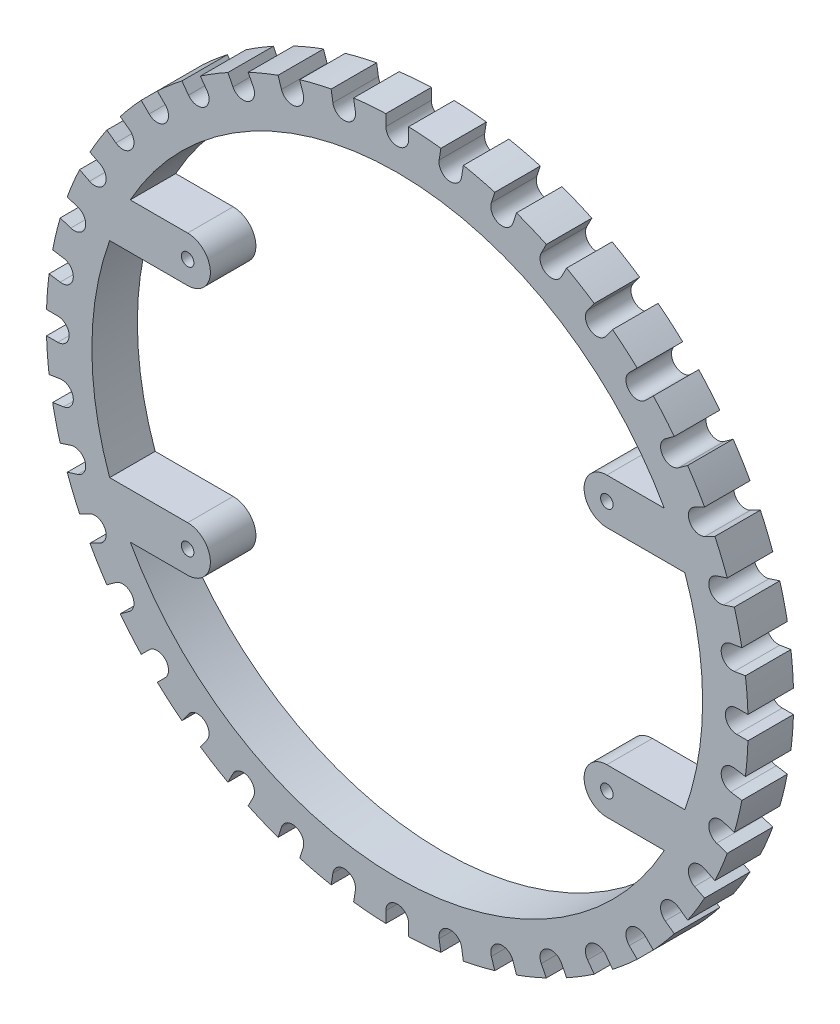
from build123d import *

# Parameters (mm, degrees)
SKETCH1_R           = 1.75
BOSS_EXTRUDE1_DEPTH = 12.7


with BuildPart() as part:
    # Sketch1 → Boss-Extrude1 (new body)
    with BuildSketch(Plane.XY):
        with BuildLine():
            Line((-3.175, -97.873515314), (-3.175, -94.75))
            ThreePointArc((-3.175, -94.75), (0, -91.575), (3.175, -94.75))
            Line((3.175, -94.75), (3.175, -97.873515314))
            ThreePointArc((3.175, -97.873515314), (7.683106949, -97.623129906), (12.174880528, -97.165209356))
            Line((12.174880528, -97.165209356), (11.686255081, -94.080149698))
            ThreePointArc((11.686255081, -94.080149698), (14.325486136, -90.44755979), (17.958076044, -93.086790845))
            Line((17.958076044, -93.086790845), (18.446701491, -96.171850503))
            ThreePointArc((18.446701491, -96.171850503), (22.860137256, -95.219324455), (27.224975092, -94.06437347))
            Line((27.224975092, -94.06437347), (26.259755778, -91.093733876))
            ThreePointArc((26.259755778, -91.093733876), (28.29823126, -87.09300048), (32.298964656, -89.131475962))
            Line((32.298964656, -89.131475962), (33.264183971, -92.102115555))
            ThreePointArc((33.264183971, -92.102115555), (37.474275114, -90.470903221), (41.604700415, -88.647360527))
            Line((41.604700415, -88.647360527), (40.186654136, -85.864288004))
            ThreePointArc((40.186654136, -85.864288004), (41.574180014, -81.593922453), (45.844545565, -82.98144833))
            Line((45.844545565, -82.98144833), (47.262591843, -85.764520854))
            ThreePointArc((47.262591843, -85.764520854), (51.16567195, -83.494788094), (54.959979935, -81.047555365))
            Line((54.959979935, -81.047555365), (53.124023698, -78.520578393))
            ThreePointArc((53.124023698, -78.520578393), (53.826434479, -74.08573126), (58.261281612, -74.788142041))
            Line((58.261281612, -74.788142041), (60.097237849, -77.315119013))
            ThreePointArc((60.097237849, -77.315119013), (63.597200133, -74.462754181), (66.961962347, -71.452090408))
            Line((66.961962347, -71.452090408), (64.753303487, -69.243431548))
            ThreePointArc((64.753303487, -69.243431548), (64.753303487, -64.753303487), (69.243431548, -64.753303487))
            Line((69.243431548, -64.753303487), (71.452090408, -66.961962347))
            ThreePointArc((71.452090408, -66.961962347), (74.462754181, -63.597200133), (77.315119013, -60.097237849))
            Line((77.315119013, -60.097237849), (74.788142041, -58.261281612))
            ThreePointArc((74.788142041, -58.261281612), (74.08573126, -53.826434479), (78.520578393, -53.124023698))
            Line((78.520578393, -53.124023698), (81.047555365, -54.959979935))
            ThreePointArc((81.047555365, -54.959979935), (83.494788094, -51.16567195), (85.764520854, -47.262591843))
            Line((85.764520854, -47.262591843), (82.98144833, -45.844545565))
            ThreePointArc((82.98144833, -45.844545565), (81.593922453, -41.574180014), (85.864288004, -40.186654136))
            Line((85.864288004, -40.186654136), (88.647360527, -41.604700415))
            ThreePointArc((88.647360527, -41.604700415), (90.470903221, -37.474275114), (92.102115555, -33.264183971))
            Line((92.102115555, -33.264183971), (89.131475962, -32.298964656))
            ThreePointArc((89.131475962, -32.298964656), (87.09300048, -28.29823126), (91.093733876, -26.259755778))
            Line((91.093733876, -26.259755778), (94.06437347, -27.224975092))
            ThreePointArc((94.06437347, -27.224975092), (95.219324455, -22.860137256), (96.171850503, -18.446701491))
            Line((96.171850503, -18.446701491), (93.086790845, -17.958076044))
            ThreePointArc((93.086790845, -17.958076044), (90.44755979, -14.325486136), (94.080149698, -11.686255081))
            Line((94.080149698, -11.686255081), (97.165209356, -12.174880528))
            ThreePointArc((97.165209356, -12.174880528), (97.623129906, -7.683106949), (97.873515314, -3.175))
            Line((97.873515314, -3.175), (94.75, -3.175))
            ThreePointArc((94.75, -3.175), (91.575, 0), (94.75, 3.175))
            Line((94.75, 3.175), (97.873515314, 3.175))
            ThreePointArc((97.873515314, 3.175), (97.623129906, 7.683106949), (97.165209356, 12.174880528))
            Line((97.165209356, 12.174880528), (94.080149698, 11.686255081))
            ThreePointArc((94.080149698, 11.686255081), (90.44755979, 14.325486136), (93.086790845, 17.958076044))
            Line((93.086790845, 17.958076044), (96.171850503, 18.446701491))
            ThreePointArc((96.171850503, 18.446701491), (95.219324455, 22.860137256), (94.06437347, 27.224975092))
            Line((94.06437347, 27.224975092), (91.093733876, 26.259755778))
            ThreePointArc((91.093733876, 26.259755778), (87.09300048, 28.29823126), (89.131475962, 32.298964656))
            Line((89.131475962, 32.298964656), (92.102115555, 33.264183971))
            ThreePointArc((92.102115555, 33.264183971), (90.470903221, 37.474275114), (88.647360527, 41.604700415))
            Line((88.647360527, 41.604700415), (85.864288004, 40.186654136))
            ThreePointArc((85.864288004, 40.186654136), (81.593922453, 41.574180014), (82.98144833, 45.844545565))
            Line((82.98144833, 45.844545565), (85.764520854, 47.262591843))
            ThreePointArc((85.764520854, 47.262591843), (83.494788094, 51.16567195), (81.047555365, 54.959979935))
            Line((81.047555365, 54.959979935), (78.520578393, 53.124023698))
            ThreePointArc((78.520578393, 53.124023698), (74.08573126, 53.826434479), (74.788142041, 58.261281612))
            Line((74.788142041, 58.261281612), (77.315119013, 60.097237849))
            ThreePointArc((77.315119013, 60.097237849), (74.462754181, 63.597200133), (71.452090408, 66.961962347))
            Line((71.452090408, 66.961962347), (69.243431548, 64.753303487))
            ThreePointArc((69.243431548, 64.753303487), (64.753303487, 64.753303487), (64.753303487, 69.243431548))
            Line((64.753303487, 69.243431548), (66.961962347, 71.452090408))
            ThreePointArc((66.961962347, 71.452090408), (63.597200133, 74.462754181), (60.097237849, 77.315119013))
            Line((60.097237849, 77.315119013), (58.261281612, 74.788142041))
            ThreePointArc((58.261281612, 74.788142041), (53.826434479, 74.08573126), (53.124023698, 78.520578393))
            Line((53.124023698, 78.520578393), (54.959979935, 81.047555365))
            ThreePointArc((54.959979935, 81.047555365), (51.16567195, 83.494788094), (47.262591843, 85.764520854))
            Line((47.262591843, 85.764520854), (45.844545565, 82.98144833))
            ThreePointArc((45.844545565, 82.98144833), (41.574180014, 81.593922453), (40.186654136, 85.864288004))
            Line((40.186654136, 85.864288004), (41.604700415, 88.647360527))
            ThreePointArc((41.604700415, 88.647360527), (37.474275114, 90.470903221), (33.264183971, 92.102115555))
            Line((33.264183971, 92.102115555), (32.298964656, 89.131475962))
            ThreePointArc((32.298964656, 89.131475962), (28.29823126, 87.09300048), (26.259755778, 91.093733876))
            Line((26.259755778, 91.093733876), (27.224975092, 94.06437347))
            ThreePointArc((27.224975092, 94.06437347), (22.860137256, 95.219324455), (18.446701491, 96.171850503))
            Line((18.446701491, 96.171850503), (17.958076044, 93.086790845))
            ThreePointArc((17.958076044, 93.086790845), (14.325486136, 90.44755979), (11.686255081, 94.080149698))
            Line((11.686255081, 94.080149698), (12.174880528, 97.165209356))
            ThreePointArc((12.174880528, 97.165209356), (7.683106949, 97.623129906), (3.175, 97.873515314))
            Line((3.175, 97.873515314), (3.175, 94.75))
            ThreePointArc((3.175, 94.75), (0, 91.575), (-3.175, 94.75))
            Line((-3.175, 94.75), (-3.175, 97.873515314))
            ThreePointArc((-3.175, 97.873515314), (-7.683106949, 97.623129906), (-12.174880528, 97.165209356))
            Line((-12.174880528, 97.165209356), (-11.686255081, 94.080149698))
            ThreePointArc((-11.686255081, 94.080149698), (-11.656953028, 93.8325779), (-11.647165563, 93.583470271))
            ThreePointArc((-11.647165563, 93.583470271), (-14.573057934, 90.418257737), (-17.958076044, 93.086790845))
            Line((-17.958076044, 93.086790845), (-18.446701491, 96.171850503))
            ThreePointArc((-18.446701491, 96.171850503), (-22.860137256, 95.219324455), (-27.224975092, 94.06437347))
            Line((-27.224975092, 94.06437347), (-26.259755778, 91.093733876))
            ThreePointArc((-26.259755778, 91.093733876), (-26.143449736, 90.609284345), (-26.104360217, 90.112604919))
            ThreePointArc((-26.104360217, 90.112604919), (-28.782680791, 86.976694438), (-32.298964656, 89.131475962))
            Line((-32.298964656, 89.131475962), (-33.264183971, 92.102115555))
            ThreePointArc((-33.264183971, 92.102115555), (-37.474275114, 90.470903221), (-41.604700415, 88.647360527))
            Line((-41.604700415, 88.647360527), (-40.186654136, 85.864288004))
            ThreePointArc((-40.186654136, 85.864288004), (-39.928325353, 85.164057197), (-39.84059985, 84.422868167))
            ThreePointArc((-39.84059985, 84.422868167), (-42.27441082, 81.33559367), (-45.844545565, 82.98144833))
            Line((-45.844545565, 82.98144833), (-47.262591843, 85.764520854))
            ThreePointArc((-47.262591843, 85.764520854), (-51.16567195, 83.494788094), (-54.959979935, 81.047555365))
            Line((-54.959979935, 81.047555365), (-53.124023698, 78.520578393))
            ThreePointArc((-53.124023698, 78.520578393), (-52.673048215, 77.635489174), (-52.517652655, 76.654360217))
            ThreePointArc((-52.517652655, 76.654360217), (-54.711523698, 73.634755778), (-58.261281612, 74.788142041))
            Line((-58.261281612, 74.788142041), (-60.097237849, 77.315119013))
            ThreePointArc((-60.097237849, 77.315119013), (-63.597200133, 74.462754181), (-66.961962347, 71.452090408))
            Line((-66.961962347, 71.452090408), (-64.753303487, 69.243431548))
            ThreePointArc((-64.753303487, 69.243431548), (-64.065050002, 68.213387415), (-63.823367517, 66.998367517))
            ThreePointArc((-63.823367517, 66.998367517), (-65.78334762, 64.065050002), (-69.243431548, 64.753303487))
            Line((-69.243431548, 64.753303487), (-71.452090408, 66.961962347))
            ThreePointArc((-71.452090408, 66.961962347), (-74.462754181, 63.597200133), (-77.315119013, 60.097237849))
            Line((-77.315119013, 60.097237849), (-74.788142041, 58.261281612))
            ThreePointArc((-74.788142041, 58.261281612), (-73.825414503, 57.134072491), (-73.479360217, 55.692652655))
            ThreePointArc((-73.479360217, 55.692652655), (-75.21294038, 52.86370694), (-78.520578393, 53.124023698))
            Line((-78.520578393, 53.124023698), (-81.047555365, 54.959979935))
            ThreePointArc((-81.047555365, 54.959979935), (-83.494788094, 51.16567195), (-85.764520854, 47.262591843))
            Line((-85.764520854, 47.262591843), (-82.98144833, 45.844545565))
            ThreePointArc((-82.98144833, 45.844545565), (-81.715735645, 44.674532793), (-81.247868167, 43.01559985))
            ThreePointArc((-81.247868167, 43.01559985), (-82.763935224, 40.308467328), (-85.864288004, 40.186654136))
            Line((-85.864288004, 40.186654136), (-88.647360527, 41.604700415))
            ThreePointArc((-88.647360527, 41.604700415), (-90.470903221, 37.474275114), (-92.102115555, 33.264183971))
            Line((-92.102115555, 33.264183971), (-89.131475962, 32.298964656))
            ThreePointArc((-89.131475962, 32.298964656), (-87.543975962, 31.145578393), (-86.937604919, 29.279360217))
            ThreePointArc((-86.937604919, 29.279360217), (-88.246386743, 26.71073126), (-91.093733876, 26.259755778))
            Line((-91.093733876, 26.259755778), (-94.06437347, 27.224975092))
            ThreePointArc((-94.06437347, 27.224975092), (-95.219324455, 22.860137256), (-96.171850503, 18.446701491))
            Line((-96.171850503, 18.446701491), (-93.086790845, 17.958076044))
            ThreePointArc((-93.086790845, 17.958076044), (-91.169181331, 16.884163116), (-90.408470271, 14.822165563))
            ThreePointArc((-90.408470271, 14.822165563), (-91.521472718, 12.407876622), (-94.080149698, 11.686255081))
            Line((-94.080149698, 11.686255081), (-97.165209356, 12.174880528))
            ThreePointArc((-97.165209356, 12.174880528), (-97.623129906, 7.683106949), (-97.873515314, 3.175))
            Line((-97.873515314, 3.175), (-94.75, 3.175))
            ThreePointArc((-94.75, 3.175), (-92.50493597, 2.24506403), (-91.575, 0))
            ThreePointArc((-91.575, 0), (-92.50493597, -2.24506403), (-94.75, -3.175))
            Line((-94.75, -3.175), (-97.873515314, -3.175))
            ThreePointArc((-97.873515314, -3.175), (-97.623129906, -7.683106949), (-97.165209356, -12.174880528))
            Line((-97.165209356, -12.174880528), (-94.080149698, -11.686255081))
            ThreePointArc((-94.080149698, -11.686255081), (-91.521472718, -12.407876622), (-90.408470271, -14.822165563))
            ThreePointArc((-90.408470271, -14.822165563), (-91.169181331, -16.884163116), (-93.086790845, -17.958076044))
            Line((-93.086790845, -17.958076044), (-96.171850503, -18.446701491))
            ThreePointArc((-96.171850503, -18.446701491), (-95.219324455, -22.860137256), (-94.06437347, -27.224975092))
            Line((-94.06437347, -27.224975092), (-91.093733876, -26.259755778))
            ThreePointArc((-91.093733876, -26.259755778), (-88.246386743, -26.71073126), (-86.937604919, -29.279360217))
            ThreePointArc((-86.937604919, -29.279360217), (-87.543975962, -31.145578393), (-89.131475962, -32.298964656))
            Line((-89.131475962, -32.298964656), (-92.102115555, -33.264183971))
            ThreePointArc((-92.102115555, -33.264183971), (-90.470903221, -37.474275114), (-88.647360527, -41.604700415))
            Line((-88.647360527, -41.604700415), (-85.864288004, -40.186654136))
            ThreePointArc((-85.864288004, -40.186654136), (-82.763935224, -40.308467328), (-81.247868167, -43.01559985))
            ThreePointArc((-81.247868167, -43.01559985), (-81.715735645, -44.674532793), (-82.98144833, -45.844545565))
            Line((-82.98144833, -45.844545565), (-85.764520854, -47.262591843))
            ThreePointArc((-85.764520854, -47.262591843), (-83.494788094, -51.16567195), (-81.047555365, -54.959979935))
            Line((-81.047555365, -54.959979935), (-78.520578393, -53.124023698))
            ThreePointArc((-78.520578393, -53.124023698), (-75.21294038, -52.86370694), (-73.479360217, -55.692652655))
            ThreePointArc((-73.479360217, -55.692652655), (-73.825414503, -57.134072491), (-74.788142041, -58.261281612))
            Line((-74.788142041, -58.261281612), (-77.315119013, -60.097237849))
            ThreePointArc((-77.315119013, -60.097237849), (-74.462754181, -63.597200133), (-71.452090408, -66.961962347))
            Line((-71.452090408, -66.961962347), (-69.243431548, -64.753303487))
            ThreePointArc((-69.243431548, -64.753303487), (-65.78334762, -64.065050002), (-63.823367517, -66.998367517))
            ThreePointArc((-63.823367517, -66.998367517), (-64.065050002, -68.213387415), (-64.753303487, -69.243431548))
            Line((-64.753303487, -69.243431548), (-66.961962347, -71.452090408))
            ThreePointArc((-66.961962347, -71.452090408), (-63.597200133, -74.462754181), (-60.097237849, -77.315119013))
            Line((-60.097237849, -77.315119013), (-58.261281612, -74.788142041))
            ThreePointArc((-58.261281612, -74.788142041), (-54.711523698, -73.634755778), (-52.517652655, -76.654360217))
            ThreePointArc((-52.517652655, -76.654360217), (-52.673048215, -77.635489174), (-53.124023698, -78.520578393))
            Line((-53.124023698, -78.520578393), (-54.959979935, -81.047555365))
            ThreePointArc((-54.959979935, -81.047555365), (-51.16567195, -83.494788094), (-47.262591843, -85.764520854))
            Line((-47.262591843, -85.764520854), (-45.844545565, -82.98144833))
            ThreePointArc((-45.844545565, -82.98144833), (-42.27441082, -81.33559367), (-39.84059985, -84.422868167))
            ThreePointArc((-39.84059985, -84.422868167), (-39.928325353, -85.164057197), (-40.186654136, -85.864288004))
            Line((-40.186654136, -85.864288004), (-41.604700415, -88.647360527))
            ThreePointArc((-41.604700415, -88.647360527), (-37.474275114, -90.470903221), (-33.264183971, -92.102115555))
            Line((-33.264183971, -92.102115555), (-32.298964656, -89.131475962))
            ThreePointArc((-32.298964656, -89.131475962), (-28.782680791, -86.976694438), (-26.104360217, -90.112604919))
            ThreePointArc((-26.104360217, -90.112604919), (-26.143449736, -90.609284345), (-26.259755778, -91.093733876))
            Line((-26.259755778, -91.093733876), (-27.224975092, -94.06437347))
            ThreePointArc((-27.224975092, -94.06437347), (-22.860137256, -95.219324455), (-18.446701491, -96.171850503))
            Line((-18.446701491, -96.171850503), (-17.958076044, -93.086790845))
            ThreePointArc((-17.958076044, -93.086790845), (-14.573057934, -90.418257737), (-11.647165563, -93.583470271))
            ThreePointArc((-11.647165563, -93.583470271), (-11.656953028, -93.8325779), (-11.686255081, -94.080149698))
            Line((-11.686255081, -94.080149698), (-12.174880528, -97.165209356))
            ThreePointArc((-12.174880528, -97.165209356), (-7.683106949, -97.623129906), (-3.175, -97.873515314))
        make_face()
        with Locations((-58.5, -35)):
            Circle(SKETCH1_R, mode=Mode.SUBTRACT)
        with BuildLine():
            ThreePointArc((-58.5, -41.35), (-52.15, -35), (-58.5, -28.65))
            Line((-58.5, -28.65), (-80.265049212, -28.65))
            ThreePointArc((-80.265049212, -28.65), (-85.225, 0), (-80.265049212, 28.65))
            Line((-80.265049212, 28.65), (-58.5, 28.65))
            ThreePointArc((-58.5, 28.65), (-52.15, 35), (-58.5, 41.35))
            Line((-58.5, 41.35), (-74.521662119, 41.35))
            ThreePointArc((-74.521662119, 41.35), (0, 85.225), (74.521662119, 41.35))
            Line((74.521662119, 41.35), (58.5, 41.35))
            ThreePointArc((58.5, 41.35), (52.15, 35), (58.5, 28.65))
            Line((58.5, 28.65), (80.265049212, 28.65))
            ThreePointArc((80.265049212, 28.65), (85.225, 0), (80.265049212, -28.65))
            Line((80.265049212, -28.65), (58.5, -28.65))
            ThreePointArc((58.5, -28.65), (52.15, -35), (58.5, -41.35))
            Line((58.5, -41.35), (74.521662119, -41.35))
            ThreePointArc((74.521662119, -41.35), (0, -85.225), (-74.521662119, -41.35))
            Line((-74.521662119, -41.35), (-58.5, -41.35))
        make_face(mode=Mode.SUBTRACT)
        with Locations((58.5, -35)):
            Circle(SKETCH1_R, mode=Mode.SUBTRACT)
        with Locations((-58.5, 35)):
            Circle(SKETCH1_R, mode=Mode.SUBTRACT)
        with Locations((58.5, 35)):
            Circle(SKETCH1_R, mode=Mode.SUBTRACT)
    extrude(amount=BOSS_EXTRUDE1_DEPTH)


solid = part.part
